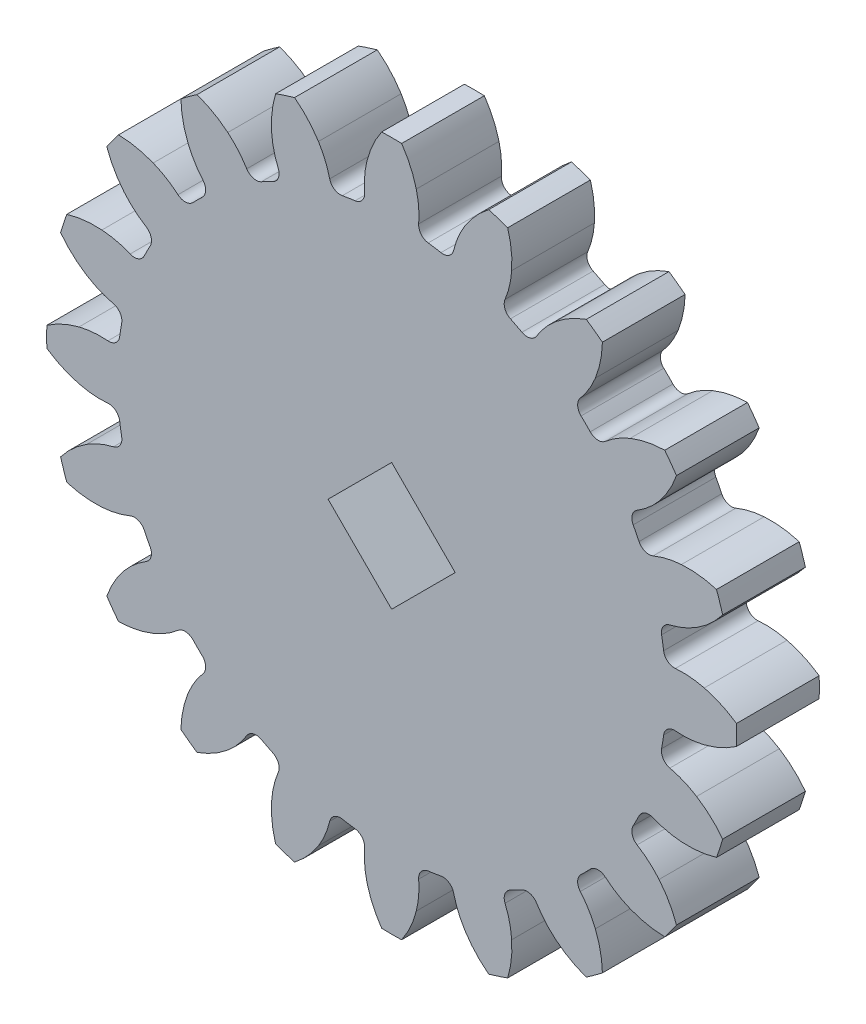
from build123d import *

# Parameters (mm, degrees)
SKETCH1_R          = 24.369889214
GEAR_BASE_DEPTH    = 2.921
GEAR_CUT_DEPTH     = 35.955857372
GEAR_TEETH_COUNT   = 20
CUT_EXTRUDE2_DEPTH = 35.955857372


with BuildPart() as part:
    # Sketch1 → GEAR_BASE (new, symmetric)
    with BuildSketch(Plane.XY):
        Circle(SKETCH1_R)
    extrude(amount=GEAR_BASE_DEPTH, both=True)

    # Sketch2 → GEAR_CUT (cut, through all)
    with BuildSketch(Plane.XY.offset(2.921)):
        with BuildLine():
            ThreePointArc((-23.385098229, -6.857746066), (-24.069855438, -3.812290582), (-24.359710133, -0.704288685))
            ThreePointArc((-24.359710133, -0.704288685), (-23.269712112, -1.325112865), (-22.085991388, -1.740231634))
            ThreePointArc((-22.085991388, -1.740231634), (-21.071786382, -1.909261282), (-20.043593299, -1.910603277))
            ThreePointArc((-20.043593299, -1.910603277), (-19.494584173, -2.079747826), (-19.212646294, -2.580279473))
            ThreePointArc((-19.212646294, -2.580279473), (-19.146475917, -3.032503872), (-19.06966266, -3.483042605))
            ThreePointArc((-19.06966266, -3.483042605), (-19.183128733, -4.046200086), (-19.652998899, -4.376719261))
            ThreePointArc((-19.652998899, -4.376719261), (-20.630453931, -4.69572471), (-21.542787178, -5.169888041))
            ThreePointArc((-21.542787178, -5.169888041), (-22.540293731, -5.930479272), (-23.385098229, -6.857746066))
        make_face()
    gear_cut = extrude(amount=-GEAR_CUT_DEPTH, mode=Mode.SUBTRACT)

    # GEAR_TEETH: GEAR_CUT ×20 about axis
    gear_teeth_axis = Axis((0, 0, 50), (0, 0, -1))
    for i in range(1, GEAR_TEETH_COUNT):
        add(gear_cut.rotate(gear_teeth_axis, i * 360 / GEAR_TEETH_COUNT), mode=Mode.SUBTRACT)

    # Sketch9 → Cut-Extrude2 (cut, through all)
    with BuildSketch(Plane(origin=(0, 0, -2.921), x_dir=(-1, 0, 0), z_dir=(0, 0, -1))):
        Polygon((-4.490128061, 0), (0, -4.490128061), (4.490128061, 0), (0, 4.490128061), align=None)
    extrude(amount=-CUT_EXTRUDE2_DEPTH, mode=Mode.SUBTRACT)


solid = part.part
